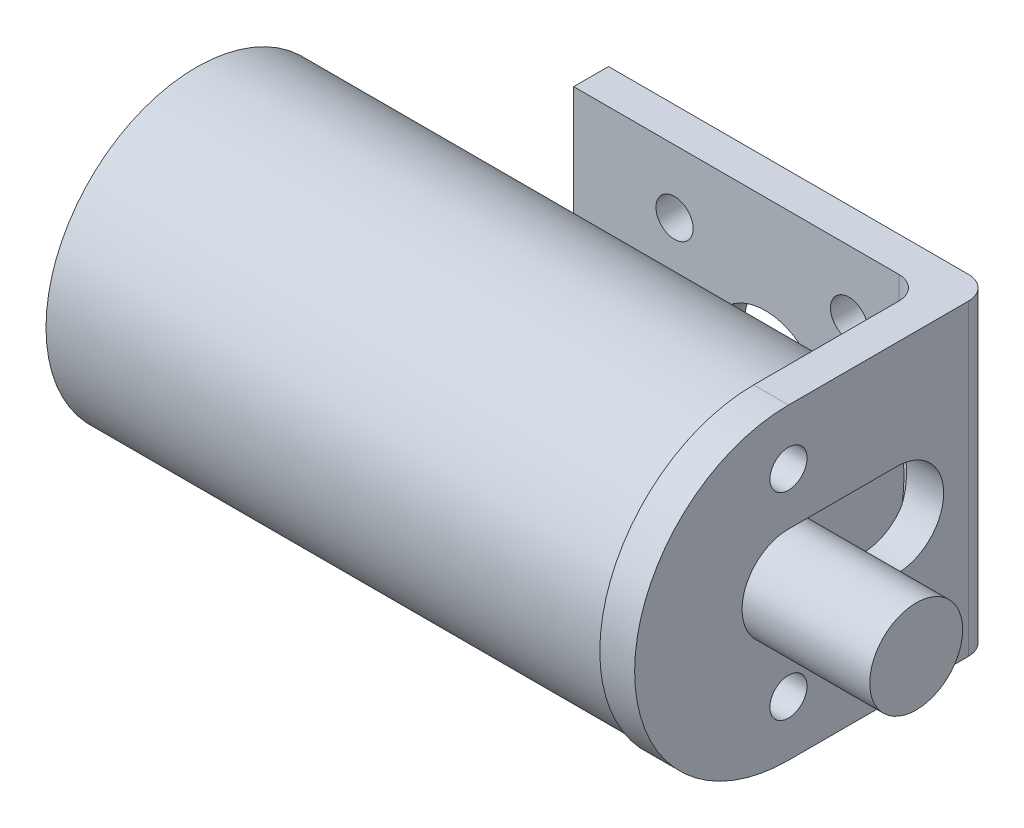
from build123d import *

# Parameters (mm, degrees)
EXTRUDE_1_DEPTH     = 26.5
SKETCH_4_R          = 4.8
SKETCH_4_R_2        = 1.6
CUT_EXTRUDE_1_DEPTH = 26
SKETCH_5_R          = 1.6
CUT_EXTRUDE_2_DEPTH = 26
SKETCH_6_R          = 12.95
EXTRUDE_2_DEPTH     = 48
EXTRUDE_START       = 14
SKETCH_7_R          = 4
EXTRUDE_3_DEPTH     = 14


with BuildPart() as part:
    # 草图2 → 凸台-拉伸1 (new body)
    with BuildSketch(Plane(origin=(0, 0, 0), x_dir=(1, 0, 0), z_dir=(0, 1, 0))):
        with BuildLine():
            Line((-23.472034258, 6.497634693), (-23.472034258, 3.497634693))
            Line((-23.472034258, 3.497634693), (4.527965742, 3.497634693))
            ThreePointArc((4.527965742, 3.497634693), (5.942179305, 2.911848255), (6.527965742, 1.497634693))
            Line((6.527965742, 1.497634693), (6.527965742, -26.502365307))
            Line((6.527965742, -26.502365307), (9.527965742, -26.502365307))
            Line((9.527965742, -26.502365307), (9.527965742, 4.497634693))
            ThreePointArc((9.527965742, 4.497634693), (8.942179305, 5.911848255), (7.527965742, 6.497634693))
            Line((7.527965742, 6.497634693), (-23.472034258, 6.497634693))
        make_face()
    extrude(amount=EXTRUDE_1_DEPTH)

    # 草图4 → 切除-拉伸1 (cut)
    with BuildSketch(Plane(origin=(0, 0, -6.497634693), x_dir=(-1, 0, 0), z_dir=(0, 0, -1))):
        with Locations((6.972034258, 13.25)):
            Circle(SKETCH_4_R)
        with Locations((-0.244612027, 21.054928982)):
            Circle(SKETCH_4_R_2)
        with Locations((14.788478141, 21.054928982)):
            Circle(SKETCH_4_R_2)
        with Locations((14.788478141, 6.021838814)):
            Circle(SKETCH_4_R_2)
        with Locations((-0.244612027, 6.021838814)):
            Circle(SKETCH_4_R_2)
    extrude(amount=-CUT_EXTRUDE_1_DEPTH, mode=Mode.SUBTRACT)

    # 草图5 → 切除-拉伸2 (cut)
    with BuildSketch(Plane(origin=(9.527965742, 0, 0), x_dir=(0, 0, -1), z_dir=(1, 0, 0))):
        with BuildLine():
            Line((-26.502365307, 26.5), (-26.502365307, 0))
            Line((-26.502365307, 0), (-11.002365307, 0))
            ThreePointArc((-11.002365307, 0), (-24.252365307, 13.25), (-11.002365307, 26.5))
            Line((-11.002365307, 26.5), (-26.502365307, 26.5))
        make_face()
        with BuildLine():
            Line((-11.002365307, 9.25), (-1.637230429, 9.25))
            ThreePointArc((-1.637230429, 9.25), (2.362769571, 13.25), (-1.637230429, 17.25))
            Line((-1.637230429, 17.25), (-11.002365307, 17.25))
            ThreePointArc((-11.002365307, 17.25), (-15.002365307, 13.25), (-11.002365307, 9.25))
        make_face()
        with Locations((-11.002365307, 4.75)):
            Circle(SKETCH_5_R)
        with Locations((-11.002365307, 21.75)):
            Circle(SKETCH_5_R)
    extrude(amount=-CUT_EXTRUDE_2_DEPTH, mode=Mode.SUBTRACT)

    # 草图6 → 凸台-拉伸2 (add)
    with BuildSketch(Plane.ZY.offset(-6.527965742)):
        with Locations(Location((11.002365307, 13.25, 0), (0, 0, 170.757909694))):
            Circle(SKETCH_6_R)
    extrude(amount=EXTRUDE_2_DEPTH)

    # 草图7 → 凸台-拉伸3 (add)
    with BuildSketch(Plane(origin=(6.527965742, 0, 0), x_dir=(0, 0, -1), z_dir=(1, 0, 0)).offset(EXTRUDE_START)):
        with Locations(Location((-11.002365307, 13.25, 0), (0, 0, 270))):
            Circle(SKETCH_7_R)
    extrude(amount=-EXTRUDE_3_DEPTH)


solid = part.part
